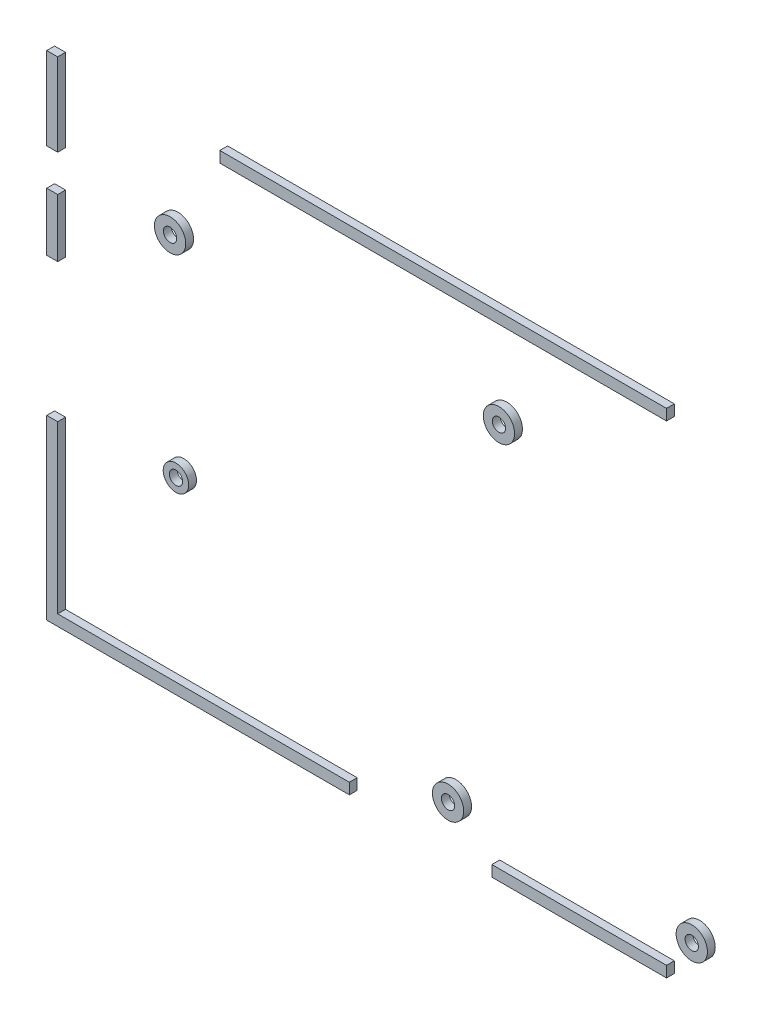
from build123d import *

# Parameters (mm, degrees)
SKETCH1_W           = 114.1
SKETCH1_H           = 2.8
SKETCH1_R           = 4
SKETCH1_R_2         = 1.7
SKETCH1_W_2         = 2.8
SKETCH1_H_2         = 21.1
SKETCH1_H_3         = 14.85
SKETCH1_H_4         = 42.5
SKETCH1_R_3         = 3.25
SKETCH1_W_3         = 44.6
BOSS_EXTRUDE1_DEPTH = 2


with BuildPart() as part:
    # Sketch1 → Boss-Extrude1 (new body)
    # profile 1 of 11: a face of its own
    with BuildSketch(Plane.XY):
        with Locations((-74.75, 61.6)):
            Rectangle(SKETCH1_W, SKETCH1_H)
    # profile 2 of 11: a face of its own
    with BuildSketch(Plane.XY):
        with Locations((-60.5, 38)):
            Circle(SKETCH1_R)
        with Locations((-60.5, 38)):
            Circle(SKETCH1_R_2, mode=Mode.SUBTRACT)
    # profile 3 of 11: a face of its own
    with BuildSketch(Plane.XY):
        with Locations((-144.5, 38)):
            Circle(SKETCH1_R)
        with Locations((-144.5, 38)):
            Circle(SKETCH1_R_2, mode=Mode.SUBTRACT)
    # profile 4 of 11: a face of its own
    with BuildSketch(Plane.XY):
        with Locations((-174.6, 52.45)):
            Rectangle(SKETCH1_W_2, SKETCH1_H_2)
    # profile 5 of 11: a face of its own
    with BuildSketch(Plane.XY):
        with Locations((-174.6, 25.125)):
            Rectangle(SKETCH1_W_2, SKETCH1_H_3)
    # profile 6 of 11: a face of its own
    with BuildSketch(Plane.XY):
        with Locations((-174.6, -38.95)):
            Rectangle(SKETCH1_W_2, SKETCH1_H_4)
    # profile 7 of 11: a face of its own
    with BuildSketch(Plane.XY):
        Polygon((-98.7, -60.2), (-173.2, -60.2), (-176, -60.2), (-176, -63), (-98.7, -63), align=None)
    # profile 8 of 11: a face of its own
    with BuildSketch(Plane.XY):
        with Locations((-143, -15)):
            Circle(SKETCH1_R_3)
        with Locations((-143, -15)):
            Circle(SKETCH1_R_2, mode=Mode.SUBTRACT)
    # profile 9 of 11: a face of its own
    with BuildSketch(Plane.XY):
        with Locations((-40, -61.6)):
            Rectangle(SKETCH1_W_3, SKETCH1_H)
    # profile 10 of 11: a face of its own
    with BuildSketch(Plane.XY):
        with Locations((-73.5, -52)):
            Circle(SKETCH1_R)
        with Locations((-73.5, -52)):
            Circle(SKETCH1_R_2, mode=Mode.SUBTRACT)
    # profile 11 of 11: a face of its own
    with BuildSketch(Plane.XY):
        with Locations((-11.25, -52)):
            Circle(SKETCH1_R)
        with Locations((-11.25, -52)):
            Circle(SKETCH1_R_2, mode=Mode.SUBTRACT)
    extrude(amount=BOSS_EXTRUDE1_DEPTH)


solid = part.part
